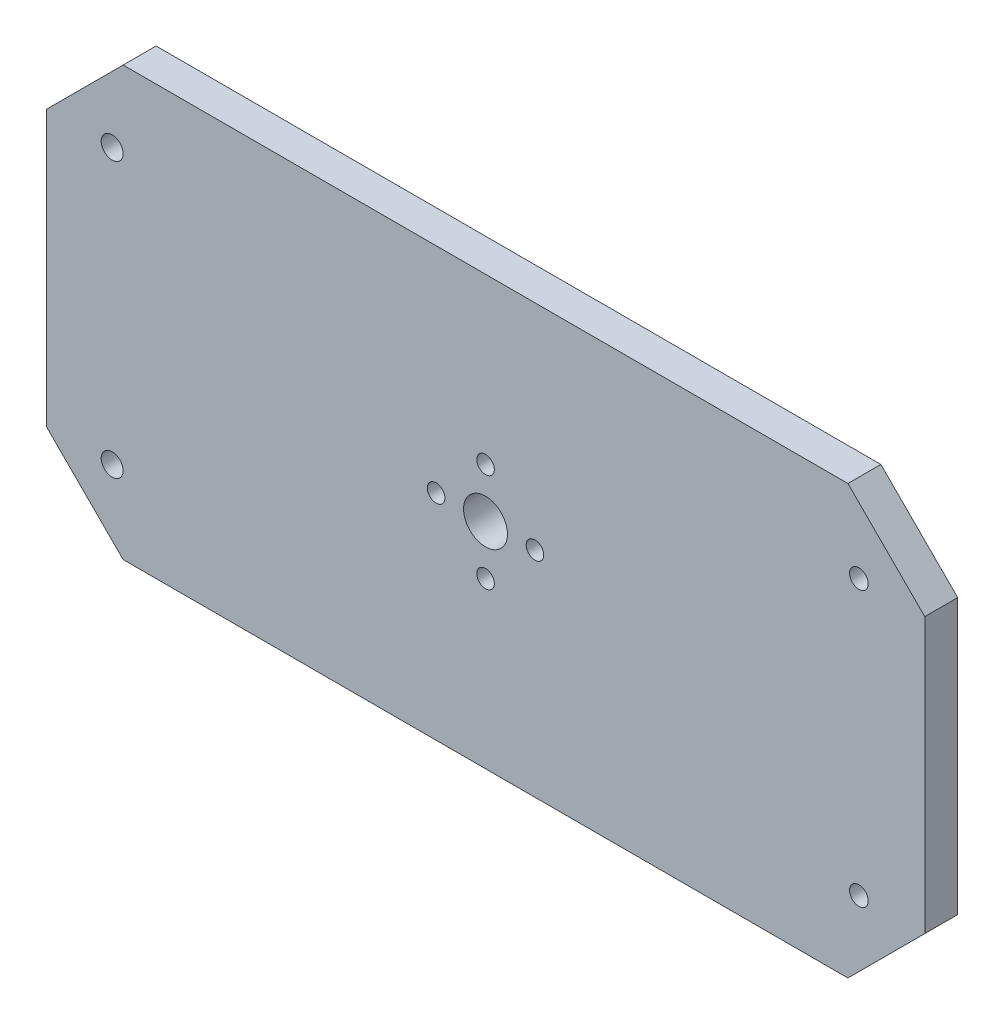
from build123d import *

# Parameters (mm, degrees)
SKETCH_1_R               = 4
SKETCH_1_R_2             = 1.6
SKETCH_1_R_3             = 2
SKETCH_1_R_4             = 1.7
F_06_ROTATING_YOKE_DEPTH = 6


with BuildPart() as part:
    # Эскиз1 → 06_Rotating_yoke (new body)
    with BuildSketch(Plane.XY):
        Polygon((-66, -39), (66, -39), (80, -25), (80, 25), (66, 39), (-66, 39), (-80, 25), (-80, -25), align=None)
        Circle(SKETCH_1_R, mode=Mode.SUBTRACT)
        with Locations((-9, 0)):
            Circle(SKETCH_1_R_2, mode=Mode.SUBTRACT)
        with Locations((9, 0)):
            Circle(SKETCH_1_R_2, mode=Mode.SUBTRACT)
        with Locations((0, 9)):
            Circle(SKETCH_1_R_2, mode=Mode.SUBTRACT)
        with Locations((0, -9)):
            Circle(SKETCH_1_R_2, mode=Mode.SUBTRACT)
        with Locations((-68, -25)):
            Circle(SKETCH_1_R_3, mode=Mode.SUBTRACT)
        with Locations((-68, 25)):
            Circle(SKETCH_1_R_3, mode=Mode.SUBTRACT)
        with Locations((68, -25)):
            Circle(SKETCH_1_R_4, mode=Mode.SUBTRACT)
        with Locations((68, 25)):
            Circle(SKETCH_1_R_4, mode=Mode.SUBTRACT)
    extrude(amount=F_06_ROTATING_YOKE_DEPTH)


solid = part.part
